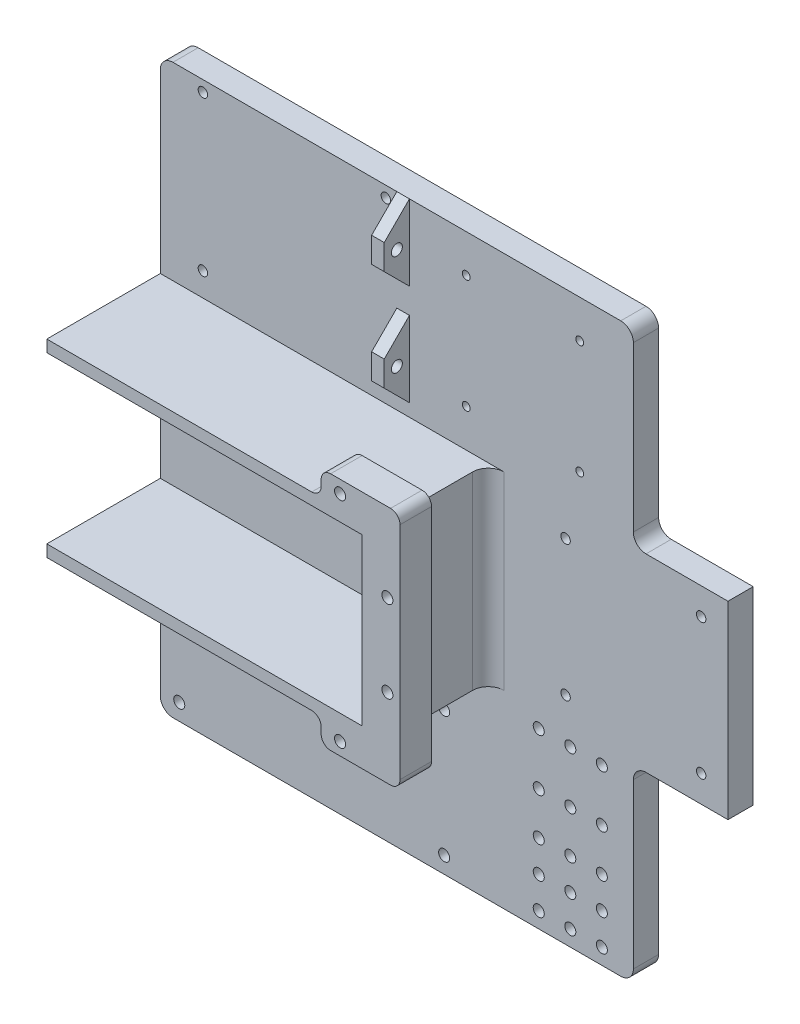
from build123d import *

# Parameters (mm, degrees)
SKETCH_1_W             = 60
SKETCH_1_H             = 60
EXTRUDE_1_DEPTH        = 8
HOLE_WIZARD_1_D        = 3
HOLE_WIZARD_2_D        = 5
HOLE_WIZARD_2_DEPTH    = 3
SKETCH_9_W             = 25
SKETCH_9_H             = 60
EXTRUDE_2_DEPTH        = 8
SKETCH_10_W            = 4
SKETCH_10_H            = 60
EXTRUDE_3_DEPTH        = 20
FILLET_1_R             = 5
SKETCH_11_W            = 100
SKETCH_11_H            = 60
EXTRUDE_4_DEPTH        = 8
SKETCH_17_W            = 180
SKETCH_17_H            = 60
EXTRUDE_5_DEPTH        = 8
HOLE_WIZARD_3_D        = 3
HOLE_WIZARD_4_D        = 5
HOLE_WIZARD_4_DEPTH    = 3
HOLE_WIZARD_5_D        = 3.5
HOLE_WIZARD_6_D        = 6.5
HOLE_WIZARD_6_DEPTH    = 4
SKETCH_25_W            = 104
SKETCH_25_H            = 60
EXTRUDE_7_DEPTH        = 36
SKETCH_26_W            = 100
SKETCH_26_H            = 52.5
CUT_EXTRUDE_1_DEPTH    = 36
SKETCH_27_W            = 8
SKETCH_27_H            = 60
EXTRUDE_8_DEPTH        = 10
HOLE_WIZARD_7_D        = 3.5
HOLE_WIZARD_7_DEPTH    = 10
FILLET_2_R             = 3
HOLE_WIZARD_8_D        = 2.5
HOLE_WIZARD_9_D        = 4.2
HOLE_WIZARD_9_DEPTH    = 4
SKETCH_37_W            = 30
SKETCH_37_H            = 60
CUT_EXTRUDE_2_DEPTH    = 174.481987538
FILLET_3_R             = 4
HOLE_WIZARD_10_D       = 3.5
PATTERN_LINEAR_1_COUNT = 6
PATTERN_LINEAR_1_PITCH = 10
HOLE_WIZARD_11_D       = 6
HOLE_WIZARD_11_DEPTH   = 4
PATTERN_LINEAR_2_COUNT = 6
PATTERN_LINEAR_2_PITCH = 10
HOLE_WIZARD_12_D       = 3.5
HOLE_WIZARD_13_D       = 6
HOLE_WIZARD_13_DEPTH   = 4
EXTRUDE_9_DEPTH        = 8
EXTRUDE_10_DEPTH       = 4
HOLE_WIZARD_14_D       = 3.5


with BuildPart() as part:
    # 草图1 → 凸台-拉伸1 (new body)
    with BuildSketch(Plane.XY):
        with Locations((30, 30)):
            Rectangle(SKETCH_1_W, SKETCH_1_H)
    extrude(amount=EXTRUDE_1_DEPTH)

    # 孔1 (through all)
    with Locations(Plane(origin=(0, 0, 0), x_dir=(-1, 0, 0), z_dir=(0, 0, -1))):
        with Locations((-51.5, 51.5), (-8.5, 51.5), (-8.5, 8.5), (-51.5, 8.5)):
            Hole(HOLE_WIZARD_1_D / 2)

    # 孔2
    with Locations(Plane(origin=(0, 0, 0), x_dir=(-1, 0, 0), z_dir=(0, 0, -1))):
        with Locations((-51.5, 51.5), (-8.5, 51.5), (-8.5, 8.5), (-51.5, 8.5)):
            Hole(HOLE_WIZARD_2_D / 2, depth=HOLE_WIZARD_2_DEPTH)

    # 草图9 → 凸台-拉伸2 (add)
    with BuildSketch(Plane.XY.offset(8)):
        with Locations((-12.5, 30)):
            Rectangle(SKETCH_9_W, SKETCH_9_H)
    extrude(amount=-EXTRUDE_2_DEPTH)

    # 草图10 → 凸台-拉伸3 (add)
    with BuildSketch(Plane.XY.offset(8)):
        with Locations((-18, 30)):
            Rectangle(SKETCH_10_W, SKETCH_10_H)
    extrude(amount=EXTRUDE_3_DEPTH)

    # 圆角1
    fillet_1_edges = [part.edges().sort_by_distance(p)[0] for p in [
        (-16, 30, 8),
    ]]
    fillet(fillet_1_edges, radius=FILLET_1_R)

    # 草图11 → 凸台-拉伸4 (add)
    with BuildSketch(Plane.XY.offset(8)):
        with Locations((-70, 30)):
            Rectangle(SKETCH_11_W, SKETCH_11_H)
    extrude(amount=-EXTRUDE_4_DEPTH)

    # 草图17 → 凸台-拉伸5 (add)
    with BuildSketch(Plane.XY.offset(8)):
        with Locations((-30, 90)):
            Rectangle(SKETCH_17_W, SKETCH_17_H)
        with Locations((-30, -30)):
            Rectangle(SKETCH_17_W, SKETCH_17_H)
    extrude(amount=-EXTRUDE_5_DEPTH)

    # 孔3 (through all)
    with Locations(Plane.XY.offset(8)):
        with Locations((-106.5, 116.5), (-48.5, 116.5), (-48.5, 67.5), (-106.5, 67.5)):
            Hole(HOLE_WIZARD_3_D / 2)

    # 孔4
    with Locations(Plane(origin=(0, 0, 0), x_dir=(-1, 0, 0), z_dir=(0, 0, -1))):
        with Locations((48.5, 116.5), (106.5, 116.5), (106.5, 67.5), (48.5, 67.5)):
            Hole(HOLE_WIZARD_4_D / 2, depth=HOLE_WIZARD_4_DEPTH)

    # 孔5 (through all)
    with Locations(Plane.XY.offset(8)):
        with Locations((-114, -14.75), (-30, -14.75), (-30, -54.75), (-114, -54.75)):
            Hole(HOLE_WIZARD_5_D / 2)

    # 孔6
    with Locations(Plane(origin=(0, 0, 0), x_dir=(-1, 0, 0), z_dir=(0, 0, -1))):
        with Locations((30, -14.75), (114, -14.75), (114, -54.75), (30, -54.75)):
            Hole(HOLE_WIZARD_6_D / 2, depth=HOLE_WIZARD_6_DEPTH)

    # 草图25 → 凸台-拉伸7 (add)
    with BuildSketch(Plane.XY.offset(8)):
        with Locations((-68, 30)):
            Rectangle(SKETCH_25_W, SKETCH_25_H)
    extrude(amount=EXTRUDE_7_DEPTH)

    # 草图26 → 切除-拉伸1 (cut)
    with BuildSketch(Plane.XY.offset(44)):
        with Locations((-70, 30)):
            Rectangle(SKETCH_26_W, SKETCH_26_H)
    extrude(amount=-CUT_EXTRUDE_1_DEPTH, mode=Mode.SUBTRACT)

    # 草图27 → 凸台-拉伸8 (add)
    with BuildSketch(Plane.XY.offset(44)):
        Polygon((-33, 60), (-16, 60), (-8, 60), (-8, 68), (-33, 68), align=None)
        with Locations((-12, 30)):
            Rectangle(SKETCH_27_W, SKETCH_27_H)
        Polygon((-8, 0), (-16, 0), (-33, 0), (-33, -8), (-8, -8), align=None)
    extrude(amount=-EXTRUDE_8_DEPTH)

    # 孔7
    with Locations(Plane.XY.offset(44)):
        with Locations((-27, 64), (-12, 43), (-12, 17), (-27, -4)):
            Hole(HOLE_WIZARD_7_D / 2, depth=HOLE_WIZARD_7_DEPTH)

    # 圆角2
    fillet_2_edges = [part.edges().sort_by_distance(p)[0] for p in [
        (-33, 60, 39),
        (-33, 68, 39),
        (-8, 68, 39),
        (-8, -8, 39),
        (-33, -8, 39),
        (-33, 0, 39),
    ]]
    fillet(fillet_2_edges, radius=FILLET_2_R)

    # 孔8 (through all)
    with Locations(Plane.XY.offset(8)):
        with Locations((13, 108), (13, 72), (-23, 72), (-23, 108)):
            Hole(HOLE_WIZARD_8_D / 2)

    # 孔9
    with Locations(Plane(origin=(0, 0, 0), x_dir=(-1, 0, 0), z_dir=(0, 0, -1))):
        with Locations((-13, 108), (23, 108), (23, 72), (-13, 72)):
            Hole(HOLE_WIZARD_9_D / 2, depth=HOLE_WIZARD_9_DEPTH)

    # 草图37 → 切除-拉伸2 (cut, through all)
    with BuildSketch(Plane.XY.offset(8)):
        with Locations((45, 90)):
            Rectangle(SKETCH_37_W, SKETCH_37_H)
        with Locations((45, -30)):
            Rectangle(SKETCH_37_W, SKETCH_37_H)
    extrude(amount=-CUT_EXTRUDE_2_DEPTH, mode=Mode.SUBTRACT)

    # 圆角3
    fillet_3_edges = [part.edges().sort_by_distance(p)[0] for p in [
        (-120, 120, 4),
        (-120, -60, 4),
        (30, 60, 4),
        (30, 120, 4),
        (30, -60, 4),
        (30, 0, 4),
    ]]
    fillet(fillet_3_edges, radius=FILLET_3_R)

    # 孔10 (through all)
    with Locations(Plane.XY.offset(8)):
        with Locations((0, -55), (10, -55), (20, -55)):
            hole_wizard_10 = Hole(HOLE_WIZARD_10_D / 2)

    # 阵列(线性)1: 孔10 ×6, 2 skipped
    with Locations(*[(0, i * PATTERN_LINEAR_1_PITCH, 0) for i in range(1, PATTERN_LINEAR_1_COUNT) if i not in (3, 4)]):
        add(hole_wizard_10, mode=Mode.SUBTRACT)

    # 孔11
    with Locations(Plane(origin=(0, 0, 0), x_dir=(-1, 0, 0), z_dir=(0, 0, -1))):
        with Locations((0, -55), (-10, -55), (-20, -55)):
            hole_wizard_11 = Hole(HOLE_WIZARD_11_D / 2, depth=HOLE_WIZARD_11_DEPTH)

    # 阵列(线性)2: 孔11 ×6, 2 skipped
    with Locations(*[(0, i * PATTERN_LINEAR_2_PITCH, 0) for i in range(1, PATTERN_LINEAR_2_COUNT) if i not in (3, 4)]):
        add(hole_wizard_11, mode=Mode.SUBTRACT)

    # 孔12 (through all)
    with Locations(Plane.XY.offset(8)):
        with Locations((0, -21.5), (10, -21.5), (20, -21.5)):
            Hole(HOLE_WIZARD_12_D / 2)

    # 孔13
    with Locations(Plane(origin=(0, 0, 0), x_dir=(-1, 0, 0), z_dir=(0, 0, -1))):
        with Locations((-20, -21.5), (-10, -21.5), (0, -21.5)):
            Hole(HOLE_WIZARD_13_D / 2, depth=HOLE_WIZARD_13_DEPTH)

    # 草图48 → 凸台-拉伸9 (add)
    with BuildSketch(Plane.XY.offset(8)):
        Polygon((-45, 108), (-45, 104), (-41, 104), (-41, 112), (-45, 112), align=None)
        Polygon((-41, 80), (-45, 80), (-45, 76), (-45, 72), (-41, 72), align=None)
    extrude(amount=EXTRUDE_9_DEPTH)

    # 草图49 → 凸台-拉伸10 (add)
    with BuildSketch(Plane(origin=(-41, 0, 0), x_dir=(0, 0, -1), z_dir=(1, 0, 0))):
        Polygon((-16, 112), (-8, 120), (-8, 112), align=None)
        Polygon((-16, 104), (-8, 96), (-8, 104), align=None)
        Polygon((-16, 80), (-8, 88), (-8, 80), align=None)
        Polygon((-16, 72), (-8, 72), (-8, 64), align=None)
    extrude(amount=-EXTRUDE_10_DEPTH)

    # 孔14 (through all)
    with Locations(Plane(origin=(-41, 0, 0), x_dir=(0, 0, -1), z_dir=(1, 0, 0))):
        with Locations((-12, 108), (-12, 76)):
            Hole(HOLE_WIZARD_14_D / 2)


solid = part.part
